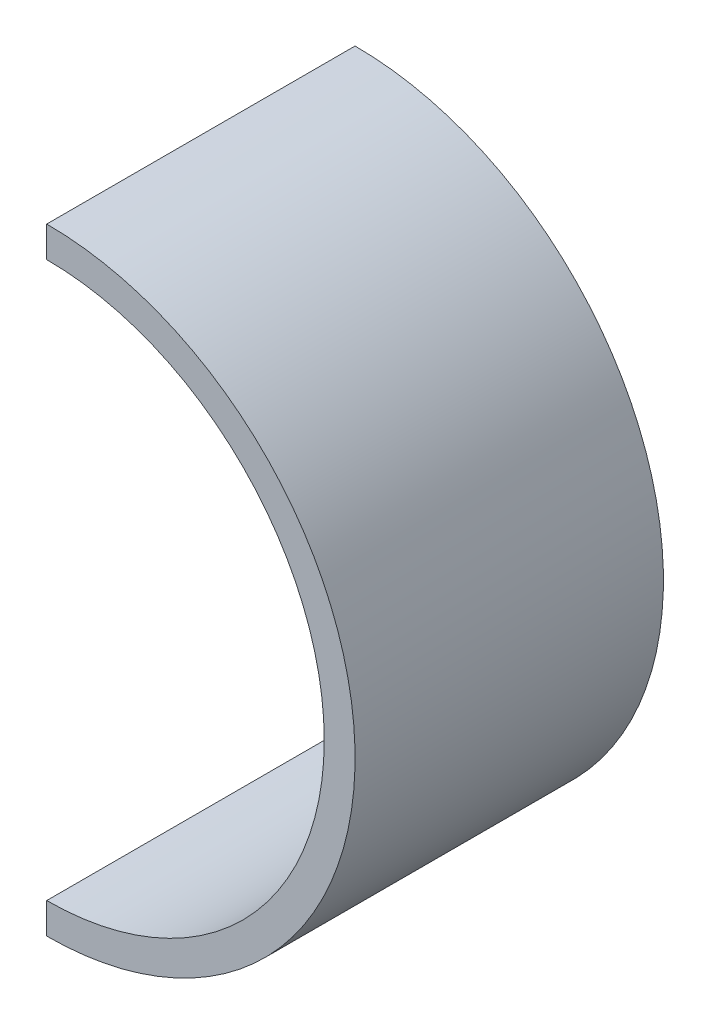
from build123d import *

# Parameters (mm, degrees)
BOSS_EXTRUDE1_DEPTH = 25


with BuildPart() as part:
    # Sketch1 → Boss-Extrude1 (new, symmetric)
    with BuildSketch(Plane.XY):
        with BuildLine():
            Line((0, 45), (0, 50))
            ThreePointArc((0, 50), (50, 0), (0, -50))
            Line((0, -50), (0, -45))
            ThreePointArc((0, -45), (45, 0), (0, 45))
        make_face()
    extrude(amount=BOSS_EXTRUDE1_DEPTH, both=True)


solid = part.part
